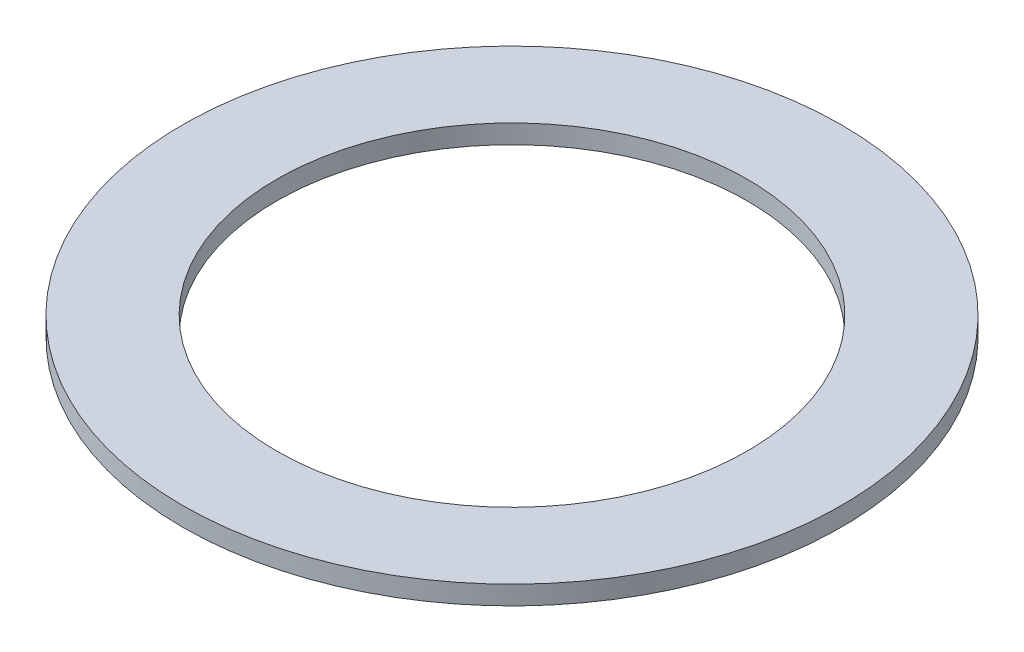
from build123d import *

# Parameters (mm, degrees)
SZKIC1_R                    = 17.5
SZKIC1_R_2                  = 12.5
DODANIE_WYCI_GNI_CIE1_DEPTH = 1


with BuildPart() as part:
    # Szkic1 → Dodanie-wyciągnięcie1 (new body)
    with BuildSketch(Plane(origin=(0, 0, 0), x_dir=(1, 0, 0), z_dir=(0, 1, 0))):
        with Locations(Location((0, 0, 0), (0, 0, 270))):
            Circle(SZKIC1_R)
        with Locations(Location((0, 0, 0), (0, 0, 270))):
            Circle(SZKIC1_R_2, mode=Mode.SUBTRACT)
    extrude(amount=DODANIE_WYCI_GNI_CIE1_DEPTH)


solid = part.part
